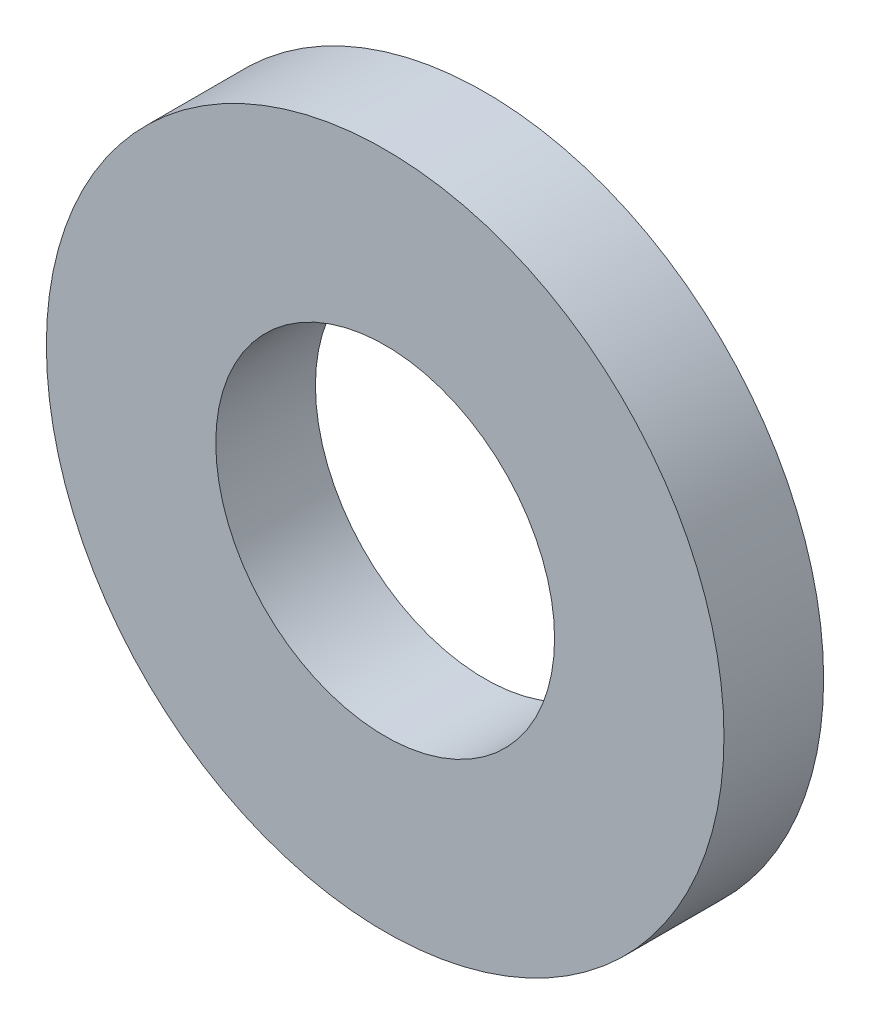
from build123d import *

# Parameters (mm, degrees)
SKETCH_1_R      = 34
SKETCH_1_R_2    = 17
EXTRUDE_1_DEPTH = 10


with BuildPart() as part:
    # Эскиз1 → Бобышка-Вытянуть1 (new body)
    with BuildSketch(Plane.XY):
        Circle(SKETCH_1_R)
        Circle(SKETCH_1_R_2, mode=Mode.SUBTRACT)
    extrude(amount=EXTRUDE_1_DEPTH)


solid = part.part
